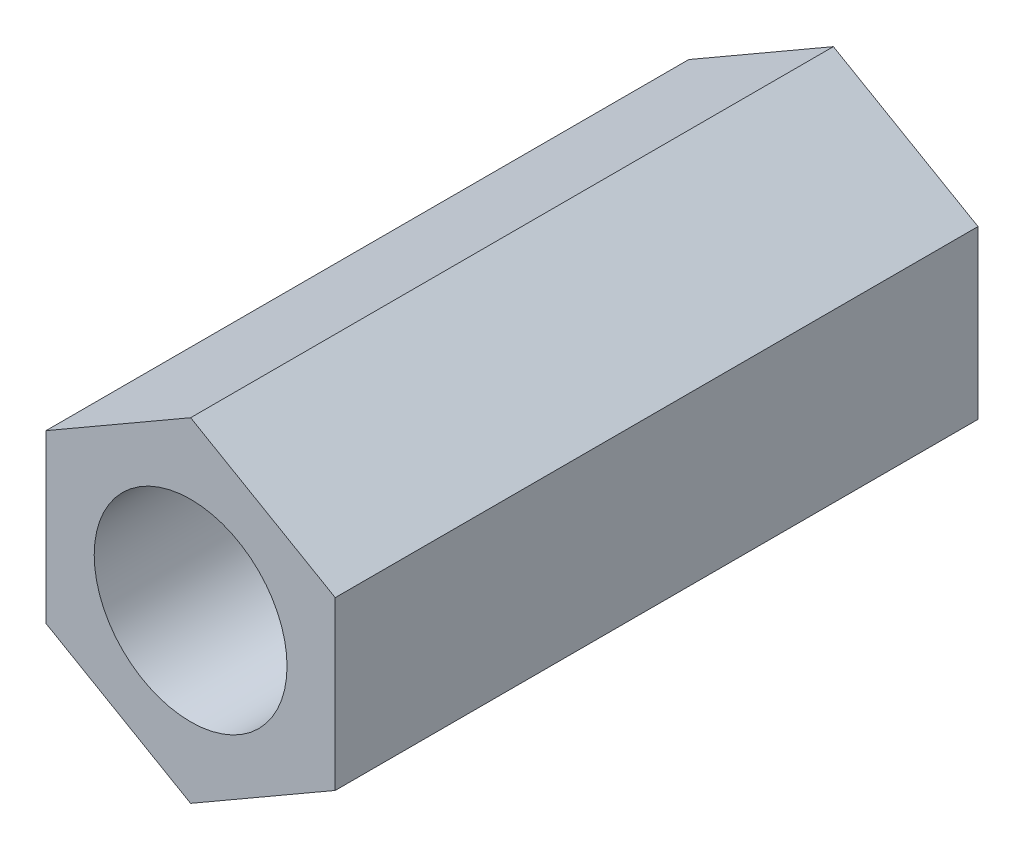
from build123d import *

# Parameters (mm, degrees)
EXTRUDE1_DEPTH      = 5
EXTRUDE1_DEPTH_BACK = 5
SKETCH1_R           = 1.5


with BuildPart() as part:
    # Sketch1 → Extrude1 (new, two sides: drawn at the far end of the back side and taken through both)
    with BuildSketch(Plane.XY.offset(-EXTRUDE1_DEPTH_BACK)):
        Polygon((0, 2.598076211), (-2.25, 1.299038106), (-2.25, -1.299038106), (0, -2.598076211), (2.25, -1.299038106), (2.25, 1.299038106), align=None)
        Circle(SKETCH1_R, mode=Mode.SUBTRACT)
    extrude(amount=EXTRUDE1_DEPTH + EXTRUDE1_DEPTH_BACK)


solid = part.part
